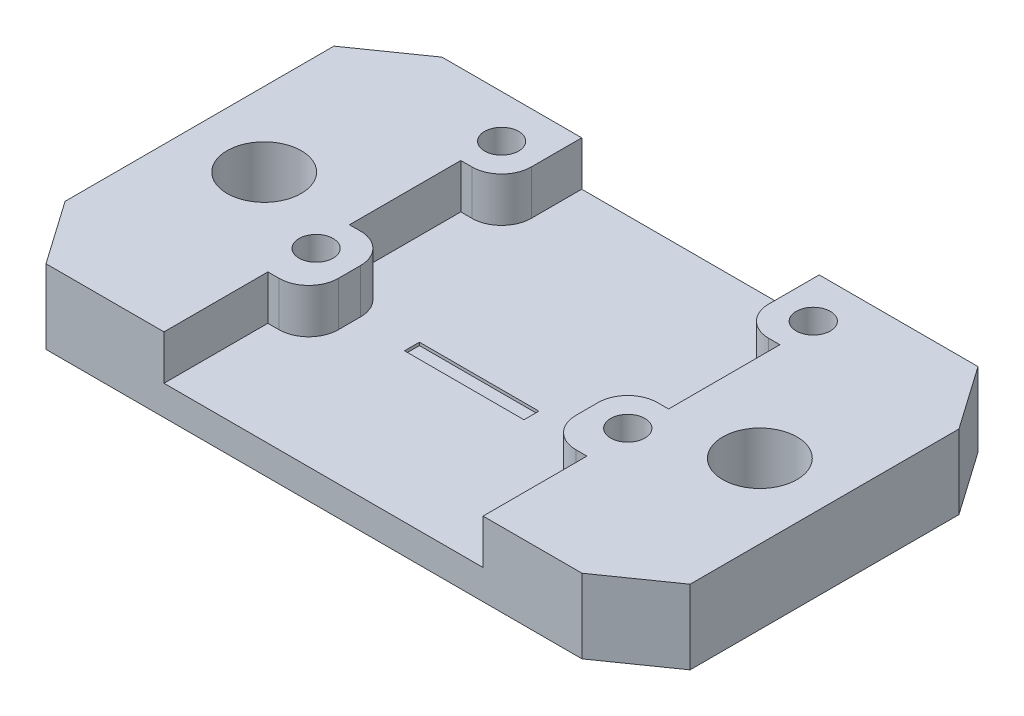
from build123d import *
from OCP.BRepFilletAPI import BRepFilletAPI_MakeChamfer

# Parameters (mm, degrees)
SKETCH2_W           = 25.4
SKETCH2_H           = 25.4
BOSS_EXTRUDE6_DEPTH = 5
BOSS_EXTRUDE7_DEPTH = 5
FILLET1_R           = 5
SKETCH5_R           = 1
CUT_EXTRUDE1_DEPTH  = 5
SKETCH6_W           = 28.098270468
SKETCH6_H           = 9.80175879
CUT_EXTRUDE2_DEPTH  = 49.905214446
SKETCH7_W           = 43.4
SKETCH7_H           = 25.4
SKETCH7_R           = 2.5
BOSS_EXTRUDE8_DEPTH = 5
SKETCH8_R           = 2.5
CUT_EXTRUDE3_DEPTH  = 10
SKETCH9_R           = 1.15
CUT_EXTRUDE4_DEPTH  = 3
FILLET2_R           = 2
CHAMFER1_SIZE       = 3
CHAMFER1_SIZE2      = 4.28444402
SKETCH10_W          = 8.049726934
SKETCH10_H          = 1.005360961
CUT_EXTRUDE5_DEPTH  = 0.2


with BuildPart() as part:
    # Sketch2 → Boss-Extrude6 (new body)
    with BuildSketch(Plane(origin=(0, 0, 0), x_dir=(1, 0, 0), z_dir=(0, 1, 0))):
        with Locations((12.7, 12.7)):
            Rectangle(SKETCH2_W, SKETCH2_H)
    extrude(amount=BOSS_EXTRUDE6_DEPTH)

    # Sketch4 → Boss-Extrude7 (add)
    with BuildSketch(Plane.XZ):
        with BuildLine():
            Line((25.4, 0), (25.4, -9.7))
            ThreePointArc((25.4, -9.7), (34.4, -12.7), (25.4, -15.7))
            Line((25.4, -15.7), (25.4, -25.4))
            Line((25.4, -25.4), (15.7, -25.4))
            ThreePointArc((15.7, -25.4), (12.7, -34.4), (9.7, -25.4))
            Line((9.7, -25.4), (0, -25.4))
            Line((0, -25.4), (0, -15.7))
            ThreePointArc((0, -15.7), (-9, -12.7), (0, -9.7))
            Line((0, -9.7), (0, 0))
            Line((0, 0), (9.7, 0))
            Line((9.7, 0), (15.7, 0))
            Line((15.7, 0), (25.4, 0))
        make_face()
    extrude(amount=-BOSS_EXTRUDE7_DEPTH)

    # Fillet1
    fillet1_edges = [part.edges().sort_by_distance(p)[0] for p in [
        (25.4, 2.5, -9.7),
        (25.4, 2.5, -15.7),
        (15.7, 2.5, -25.4),
        (9.7, 2.5, -25.4),
        (0, 2.5, -15.7),
        (0, 2.5, -9.7),
    ]]
    fillet(fillet1_edges, radius=FILLET1_R)

    # Sketch5 → Cut-Extrude1 (cut)
    with BuildSketch(Plane(origin=(0, 5, 0), x_dir=(1, 0, 0), z_dir=(0, 1, 0))):
        with Locations(Location((-4, 12.7, 0), (0, 0, 270))):
            Circle(SKETCH5_R)
        with Locations(Location((12.7, 29.4, 0), (0, 0, 270))):
            Circle(SKETCH5_R)
        with Locations(Location((29.4, 12.7, 0), (0, 0, 270))):
            Circle(SKETCH5_R)
    extrude(amount=-CUT_EXTRUDE1_DEPTH, mode=Mode.SUBTRACT)

    # Sketch6 → Cut-Extrude2 (cut, through all)
    with BuildSketch(Plane(origin=(0, 5, 0), x_dir=(1, 0, 0), z_dir=(0, 1, 0))):
        with Locations((14.049135234, 30.300879395)):
            Rectangle(SKETCH6_W, SKETCH6_H)
    extrude(amount=-CUT_EXTRUDE2_DEPTH, mode=Mode.SUBTRACT)

    # Sketch7 → Boss-Extrude8 (add)
    with BuildSketch(Plane(origin=(0, 5, 0), x_dir=(1, 0, 0), z_dir=(0, 1, 0))):
        with Locations((12.7, 12.7)):
            Rectangle(SKETCH7_W, SKETCH7_H)
        with Locations((-4, 12.7)):
            Circle(SKETCH7_R, mode=Mode.SUBTRACT)
        with Locations((29.4, 12.7)):
            Circle(SKETCH7_R, mode=Mode.SUBTRACT)
    extrude(amount=-BOSS_EXTRUDE8_DEPTH)

    # Sketch8 → Cut-Extrude3 (cut)
    with BuildSketch(Plane(origin=(0, 5, 0), x_dir=(1, 0, 0), z_dir=(0, 1, 0))):
        with Locations(Location((-4, 12.7, 0), (0, 0, 270))):
            Circle(SKETCH8_R)
        with Locations(Location((29.4, 12.7, 0), (0, 0, 270))):
            Circle(SKETCH8_R)
    extrude(amount=-CUT_EXTRUDE3_DEPTH, mode=Mode.SUBTRACT)

    # Sketch9 → Cut-Extrude4 (cut)
    with BuildSketch(Plane(origin=(0, 5, 0), x_dir=(1, 0, 0), z_dir=(0, 1, 0))):
        with Locations(Location((2.2, 10, 0), (0, 0, 270))):
            Circle(SKETCH9_R)
        with Locations(Location((2.2, 22.5, 0), (0, 0, 270))):
            Circle(SKETCH9_R)
        with Locations(Location((23.2, 22.5, 0), (0, 0, 270))):
            Circle(SKETCH9_R)
        with Locations(Location((23.2, 10, 0), (0, 0, 270))):
            Circle(SKETCH9_R)
        Polygon((23.45, 12.5), (23.45, 20), (20.7, 20), (20.7, 25.4), (4.7, 25.4), (4.7, 20), (1.95, 20), (1.95, 12.5), (4.7, 12.5), (4.7, 7), (1.95, 7), (1.95, 0), (23.45, 0), (23.45, 7), (20.7, 7), (20.7, 12.5), align=None)
    extrude(amount=-CUT_EXTRUDE4_DEPTH, mode=Mode.SUBTRACT)

    # Fillet2
    fillet2_edges = [part.edges().sort_by_distance(p)[0] for p in [
        (20.7, 3.5, -12.5),
        (20.7, 3.5, -7),
        (4.7, 3.5, -7),
        (4.7, 3.5, -12.5),
        (4.7, 3.5, -20),
        (20.7, 3.5, -20),
    ]]
    fillet(fillet2_edges, radius=FILLET2_R)

    # Chamfer1: one chamfer whose edges measure the first distance from different faces: ONE call of the kernel's chamfer builder (chamfer() names one face for all edges)
    chamfer1_edges_1 = [part.edges().sort_by_distance(p)[0] for p in [
        (34.4, 2.5, 0),
    ]]
    chamfer1_side_1 = [part.faces().sort_by_distance(p)[0] for p in [
        (34.4, 2.5, -12.7),
    ]]
    chamfer1_edges_2 = [part.edges().sort_by_distance(p)[0] for p in [
        (-9, 2.5, 0),
    ]]
    chamfer1_side_2 = [part.faces().sort_by_distance(p)[0] for p in [
        (-8.56312931, 2.5, 0),
    ]]
    chamfer1_edges_3 = [part.edges().sort_by_distance(p)[0] for p in [
        (34.4, 2.5, -25.4),
    ]]
    chamfer1_side_3 = [part.faces().sort_by_distance(p)[0] for p in [
        (33.96312931, 2.5, -25.4),
    ]]
    chamfer1_edges_4 = [part.edges().sort_by_distance(p)[0] for p in [
        (-9, 2.5, -25.4),
    ]]
    chamfer1_side_4 = [part.faces().sort_by_distance(p)[0] for p in [
        (-9, 2.5, -12.7),
    ]]
    chamfer1 = BRepFilletAPI_MakeChamfer(part.part.solid().wrapped)
    for e in chamfer1_edges_1:
        chamfer1.Add(CHAMFER1_SIZE, CHAMFER1_SIZE2, e.wrapped, chamfer1_side_1[0].wrapped)  # the first distance lies on this face
    for e in chamfer1_edges_2:
        chamfer1.Add(CHAMFER1_SIZE, CHAMFER1_SIZE2, e.wrapped, chamfer1_side_2[0].wrapped)  # the first distance lies on this face
    for e in chamfer1_edges_3:
        chamfer1.Add(CHAMFER1_SIZE, CHAMFER1_SIZE2, e.wrapped, chamfer1_side_3[0].wrapped)  # the first distance lies on this face
    for e in chamfer1_edges_4:
        chamfer1.Add(CHAMFER1_SIZE, CHAMFER1_SIZE2, e.wrapped, chamfer1_side_4[0].wrapped)  # the first distance lies on this face
    add(Compound.cast(chamfer1.Shape()), mode=Mode.REPLACE)

    # Sketch10 → Cut-Extrude5 (cut)
    with BuildSketch(Plane(origin=(0, 2, 0), x_dir=(1, 0, 0), z_dir=(0, 1, 0))):
        with Locations((12.181188926, 10.502680481)):
            Rectangle(SKETCH10_W, SKETCH10_H)
    extrude(amount=-CUT_EXTRUDE5_DEPTH, mode=Mode.SUBTRACT)


solid = part.part
